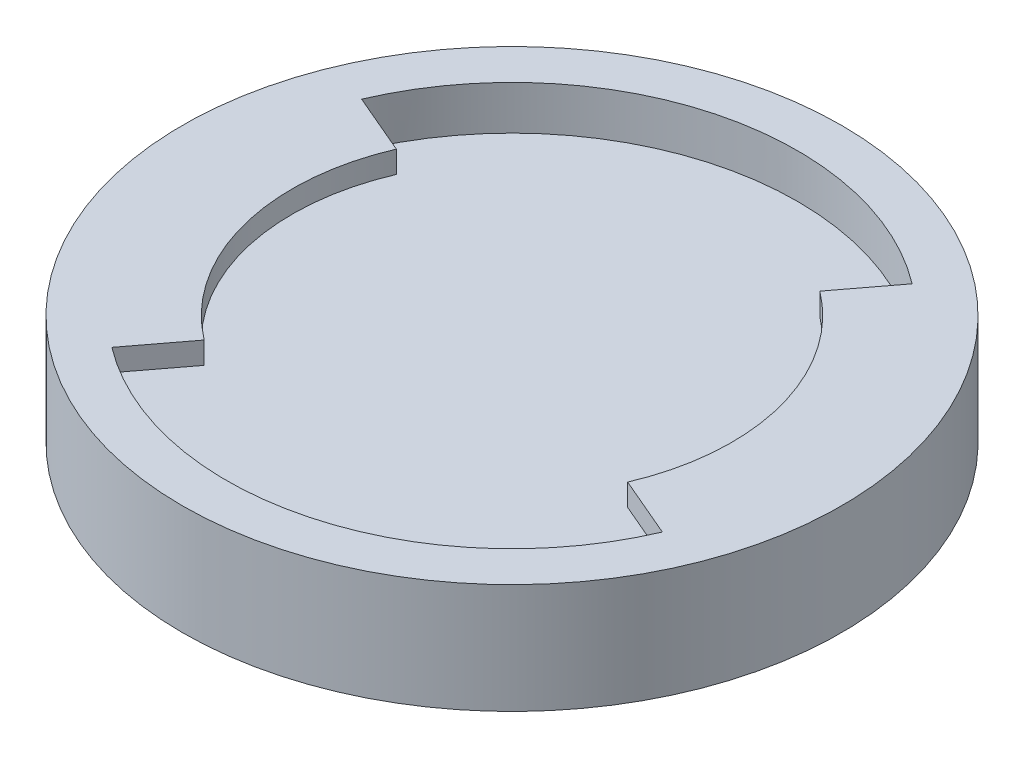
from build123d import *

# Parameters (mm, degrees)
SKIZZE1_R                       = 15
AUFSATZ_LINEAR_AUSTRAGEN1_DEPTH = 3
AUFSATZ_LINEAR_START            = 2
SKIZZE2_R                       = 15
SKIZZE2_R_2                     = 13
AUFSATZ_LINEAR_AUSTRAGEN2_DEPTH = 2
AUFSATZ_LINEAR_AUSTRAGEN3_DEPTH = 1


with BuildPart() as part:
    # Skizze1 → Aufsatz-Linear austragen1 (new body)
    with BuildSketch(Plane(origin=(0, 0, 0), x_dir=(1, 0, 0), z_dir=(0, 1, 0))):
        with Locations(Location((0, 0, 0), (0, 0, 270))):
            Circle(SKIZZE1_R)
    extrude(amount=-AUFSATZ_LINEAR_AUSTRAGEN1_DEPTH)

    # Skizze2 → Aufsatz-Linear austragen2 (add)
    with BuildSketch(Plane(origin=(0, 0, 0), x_dir=(1, 0, 0), z_dir=(0, 1, 0)).offset(AUFSATZ_LINEAR_START)):
        with Locations(Location((0, 0, 0), (0, 0, 270))):
            Circle(SKIZZE2_R)
        with Locations(Location((0, 0, 0), (0, 0, 270))):
            Circle(SKIZZE2_R_2, mode=Mode.SUBTRACT)
    extrude(amount=-AUFSATZ_LINEAR_AUSTRAGEN2_DEPTH)

    # Skizze3 → Aufsatz-Linear austragen3 (add)
    with BuildSketch(Plane(origin=(0, 2, 0), x_dir=(1, 0, 0), z_dir=(0, 1, 0))):
        with BuildLine():
            Line((-6.042078394, -7.968267609), (-7.854701912, -10.358747891))
            ThreePointArc((-7.854701912, -10.358747891), (-12.566291217, -3.329913671), (-11.953670509, 5.109771166))
            Line((-11.953670509, 5.109771166), (-9.195131161, 3.930593205))
            ThreePointArc((-9.195131161, 3.930593205), (-9.666377859, -2.561472055), (-6.042078394, -7.968267609))
        make_face()
        with BuildLine():
            Line((6.042078394, 7.968267609), (7.854701912, 10.358747891))
            ThreePointArc((7.854701912, 10.358747891), (12.566291217, 3.329913671), (11.953670509, -5.109771166))
            Line((11.953670509, -5.109771166), (9.195131161, -3.930593205))
            ThreePointArc((9.195131161, -3.930593205), (9.666377859, 2.561472055), (6.042078394, 7.968267609))
        make_face()
    extrude(amount=-AUFSATZ_LINEAR_AUSTRAGEN3_DEPTH)


solid = part.part
